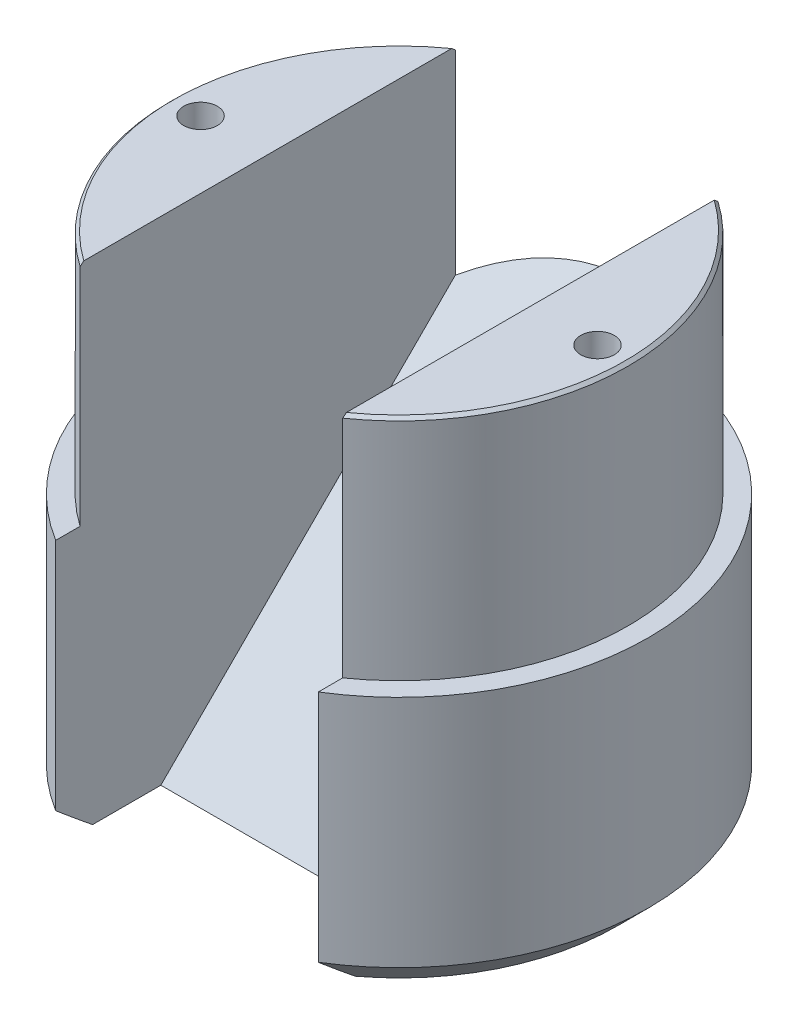
from build123d import *

# Parameters (mm, degrees)
ENL_V_MAT_EXTRU_1_DEPTH      = 12.9
ENL_V_MAT_EXTRU_1_DEPTH_BACK = 12.9
TROU_TARAUD_M4X0_71_D        = 3.3
TROU_TARAUD_M4X0_71_DEPTH    = 10
TROU_TARAUD_M4X0_71_TIP      = 0.991420021


with BuildPart() as part:
    # Esquisse1 → Révolution1 (revolve)
    with BuildSketch(Plane.XY):
        Polygon((0, -23), (21.5, -23), (24.5, -20), (24.5, 3), (22.5, 3), (22.5, 25.1), (22.2, 25.4), (0, 25.4), align=None)
    revolve(axis=Axis((0, 89.934503311, 0), (0, -1, 0)))

    # Esquisse2 → Enlèv. mat.-Extru.1 (cut, two sides: drawn at the far end of the back side and taken through both)
    with BuildSketch(Plane(origin=(0, 0, 0), x_dir=(0, 0, -1), z_dir=(1, 0, 0)).offset(-ENL_V_MAT_EXTRU_1_DEPTH_BACK)):
        Polygon((-24.5, -37), (24.5, 12), (24.5, 25.4), (-24.5, 25.4), align=None)
    extrude(amount=ENL_V_MAT_EXTRU_1_DEPTH + ENL_V_MAT_EXTRU_1_DEPTH_BACK, mode=Mode.SUBTRACT)

    # Trou taraudé M4x0.71
    with Locations(Plane(origin=(0, 25.4, 0), x_dir=(-1, 0, 0), z_dir=(0, 1, 0))):
        with Locations((-19.5, 0), (19.5, 0)):
            Hole(TROU_TARAUD_M4X0_71_D / 2, depth=TROU_TARAUD_M4X0_71_DEPTH)
            with Locations((0, 0, -(TROU_TARAUD_M4X0_71_DEPTH + TROU_TARAUD_M4X0_71_TIP / 2))):  # 118° drill point
                Cone(0, TROU_TARAUD_M4X0_71_D / 2, TROU_TARAUD_M4X0_71_TIP, mode=Mode.SUBTRACT)


solid = part.part
